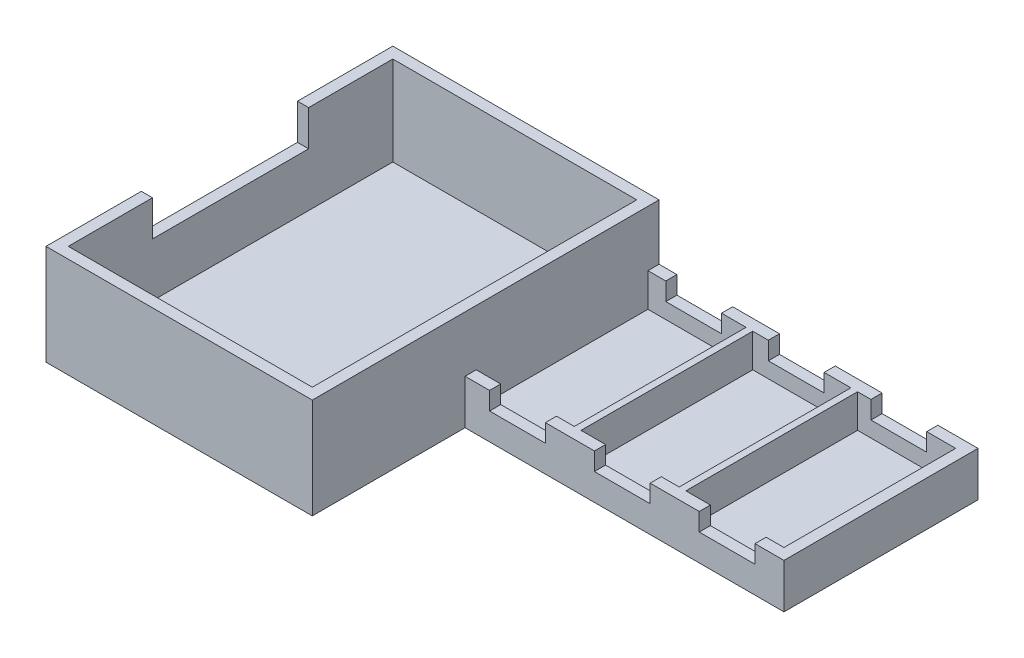
from build123d import *

# Parameters (mm, degrees)
BOSS_EXTRUDE1_DEPTH = 40
BOSS_EXTRUDE2_DEPTH = 5
SKETCH4_W           = 5
SKETCH4_H           = 77
SKETCH4_W_2         = 3
BOSS_EXTRUDE3_DEPTH = 40
SKETCH5_W           = 143
SKETCH5_H           = 87
CUT_EXTRUDE1_DEPTH  = 25
SKETCH6_W           = 25
SKETCH6_H           = 5
CUT_EXTRUDE2_DEPTH  = 8
SKETCH7_W           = 5
SKETCH7_H           = 70
CUT_EXTRUDE3_DEPTH  = 16


with BuildPart() as part:
    # Sketch1 → Boss-Extrude1 (new body)
    with BuildSketch(Plane(origin=(0, 0, 0), x_dir=(1, 0, 0), z_dir=(0, 1, 0))):
        Polygon((0, 77.75), (0, -77.75), (119.4, -77.75), (119.4, -9.25), (262.4, -9.25), (262.4, 77.75), align=None)
        Polygon((5, 72.75), (257.4, 72.75), (257.4, -4.25), (114.4, -4.25), (114.4, -72.75), (5, -72.75), align=None, mode=Mode.SUBTRACT)
    extrude(amount=BOSS_EXTRUDE1_DEPTH)

    # Sketch3 → Boss-Extrude2 (add)
    with BuildSketch(Plane.XZ):
        Polygon((119.4, 77.75), (119.4, 9.25), (262.4, 9.25), (262.4, -77.75), (0, -77.75), (0, 77.75), align=None)
    extrude(amount=BOSS_EXTRUDE2_DEPTH)

    # Sketch4 → Boss-Extrude3 (add)
    with BuildSketch(Plane(origin=(0, 0, 0), x_dir=(1, 0, 0), z_dir=(0, 1, 0))):
        with Locations((116.9, 34.25)):
            Rectangle(SKETCH4_W, SKETCH4_H)
        with Locations((164.9, 34.25)):
            Rectangle(SKETCH4_W_2, SKETCH4_H)
        with Locations((211.9, 34.25)):
            Rectangle(SKETCH4_W_2, SKETCH4_H)
    extrude(amount=BOSS_EXTRUDE3_DEPTH)

    # Sketch5 → Cut-Extrude1 (cut)
    with BuildSketch(Plane(origin=(0, 40, 0), x_dir=(1, 0, 0), z_dir=(0, 1, 0))):
        with Locations((190.9, 34.25)):
            Rectangle(SKETCH5_W, SKETCH5_H)
    extrude(amount=-CUT_EXTRUDE1_DEPTH, mode=Mode.SUBTRACT)

    # Sketch6 → Cut-Extrude2 (cut)
    with BuildSketch(Plane(origin=(0, 15, 0), x_dir=(1, 0, 0), z_dir=(0, 1, 0))):
        with Locations((142.9, -6.75)):
            Rectangle(SKETCH6_W, SKETCH6_H)
        with Locations((189.9, -6.75)):
            Rectangle(SKETCH6_W, SKETCH6_H)
        with Locations((236.9, -6.75)):
            Rectangle(SKETCH6_W, SKETCH6_H)
        with Locations((139.9, 75.25)):
            Rectangle(SKETCH6_W, SKETCH6_H)
        with Locations((185.9, 75.25)):
            Rectangle(SKETCH6_W, SKETCH6_H)
        with Locations((231.9, 75.25)):
            Rectangle(SKETCH6_W, SKETCH6_H)
    extrude(amount=-CUT_EXTRUDE2_DEPTH, mode=Mode.SUBTRACT)

    # Sketch7 → Cut-Extrude3 (cut)
    with BuildSketch(Plane(origin=(0, 40, 0), x_dir=(1, 0, 0), z_dir=(0, 1, 0))):
        with Locations((2.5, 0)):
            Rectangle(SKETCH7_W, SKETCH7_H)
    extrude(amount=-CUT_EXTRUDE3_DEPTH, mode=Mode.SUBTRACT)


solid = part.part
